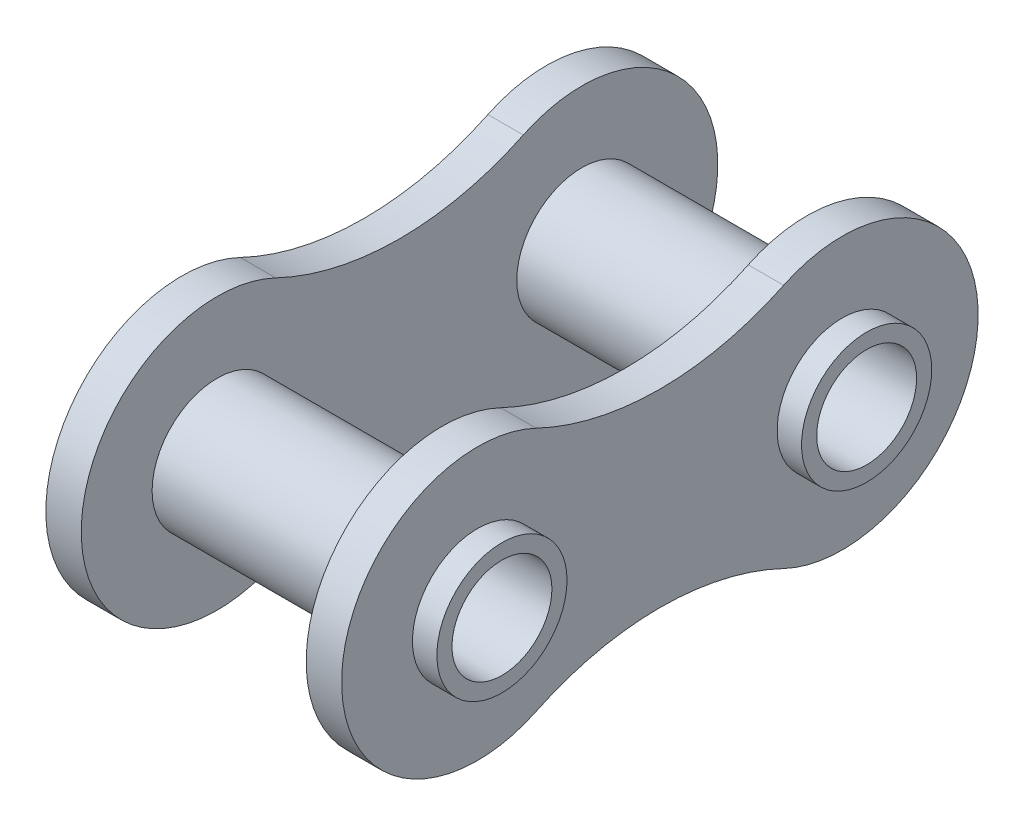
from build123d import *

# Parameters (mm, degrees)
SKETCH_1_R        = 6.8
SKETCH_1_R_2      = 5.22
EXTRUDE_1_DEPTH   = 18
EXTRUDE_1_2_DEPTH = 18
EXTRUDE_START     = 15.45
SKETCH_3_R        = 6.8
EXTRUDE_3_DEPTH   = 3.7


with BuildPart() as part:
    # Эскиз1 → Бобышка-Вытянуть1 (new, symmetric)
    with BuildSketch(Plane(origin=(0, 0, 0), x_dir=(0, 0, -1), z_dir=(1, 0, 0))):
        with Locations((-19.05, 0)):
            Circle(SKETCH_1_R)
        with Locations((-19.05, 0)):
            Circle(SKETCH_1_R_2, mode=Mode.SUBTRACT)
    extrude(amount=EXTRUDE_1_DEPTH, both=True)



with BuildPart() as body_2:
    # Эскиз1 → Extrude 1 2 (new, symmetric)
    with BuildSketch(Plane(origin=(0, 0, 0), x_dir=(0, 0, -1), z_dir=(1, 0, 0))):
        with Locations((19.05, 0)):
            Circle(SKETCH_1_R)
        with Locations((19.05, 0)):
            Circle(SKETCH_1_R_2, mode=Mode.SUBTRACT)
    extrude(amount=EXTRUDE_1_2_DEPTH, both=True)


with BuildPart() as part_1:
    add(part.part)

    add(body_2.part)  # Бобышка-Вытянуть3 merges body 2
    # Эскиз3 → Бобышка-Вытянуть3 (add)
    with BuildSketch(Plane(origin=(0, 0, 0), x_dir=(0, 0, -1), z_dir=(1, 0, 0)).offset(EXTRUDE_START)):
        with BuildLine():
            ThreePointArc((-12.929864253, 12.813428052), (-33.25, 0), (-12.929864253, -12.813428052))
            ThreePointArc((-12.929864253, -12.813428052), (0, -9.884050697), (12.929864253, -12.813428052))
            ThreePointArc((12.929864253, -12.813428052), (33.25, 0), (12.929864253, 12.813428052))
            ThreePointArc((12.929864253, 12.813428052), (0, 9.884050697), (-12.929864253, 12.813428052))
        make_face()
        with Locations((-19.05, 0)):
            Circle(SKETCH_3_R, mode=Mode.SUBTRACT)
        with Locations((19.05, 0)):
            Circle(SKETCH_3_R, mode=Mode.SUBTRACT)
    extrude_3 = extrude(amount=-EXTRUDE_3_DEPTH)

    # Зеркальное отражение1: Бобышка-Вытянуть3 across plane
    add(extrude_3.mirror(Plane(origin=(0, 0, 0), x_dir=(0, 0, 1), z_dir=(1, 0, 0))))


solid = part_1.part
